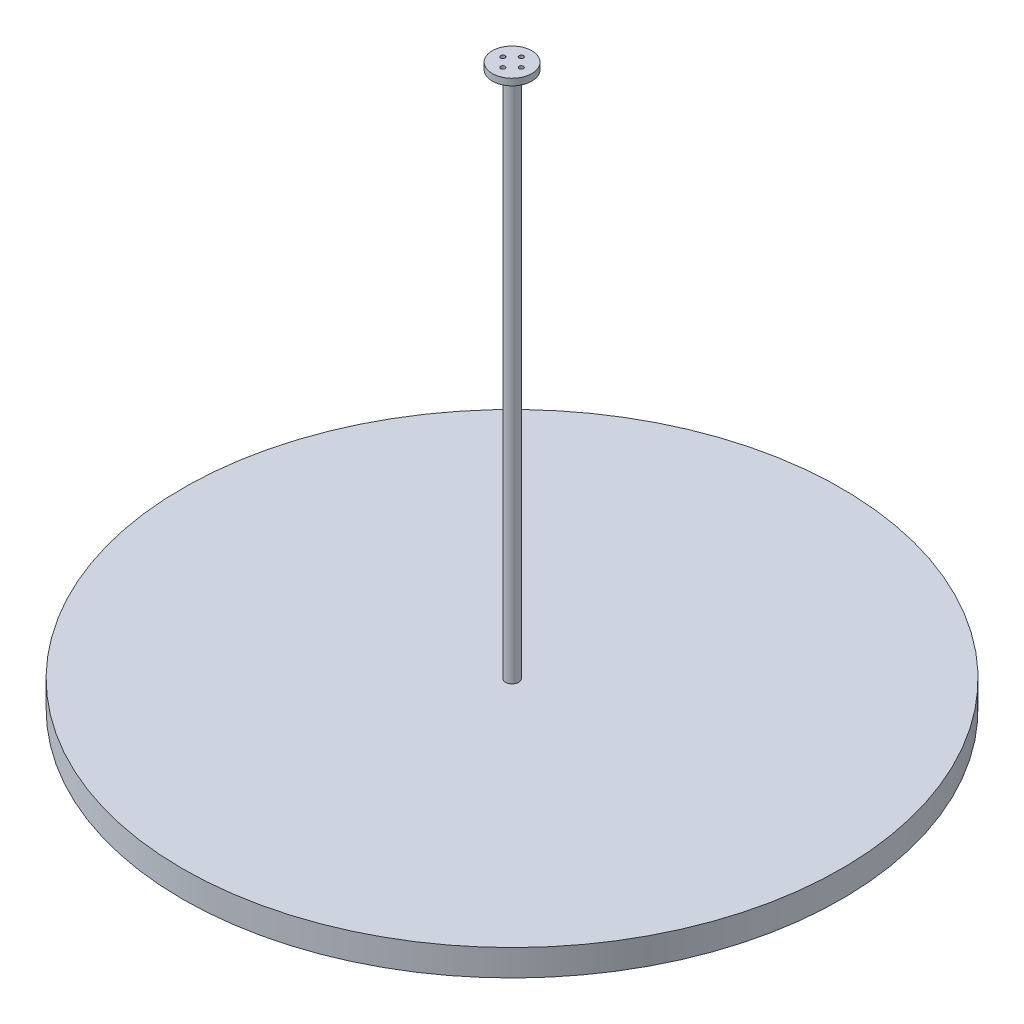
from build123d import *

# Parameters (mm, degrees)
SKETCH_1_R               = 250
EXTRUDE_1_DEPTH          = 20
SKETCH_2_R               = 5
EXTRUDE_2_DEPTH          = 400
SKETCH_3_R               = 15
EXTRUDE_3_DEPTH          = 5
SKETCH_4_R               = 1.65
CUT_EXTRUDE_1_DEPTH      = 5
PATTERN_CIRCULAR_1_COUNT = 4


with BuildPart() as part:
    # 草图1 → 凸台-拉伸1 (new body)
    with BuildSketch(Plane(origin=(0, 0, 0), x_dir=(1, 0, 0), z_dir=(0, 1, 0))):
        with Locations(Location((0, 0, 0), (0, 0, 270))):
            Circle(SKETCH_1_R)
    extrude(amount=EXTRUDE_1_DEPTH)

    # 草图2 → 凸台-拉伸2 (add)
    with BuildSketch(Plane(origin=(0, 20, 0), x_dir=(1, 0, 0), z_dir=(0, 1, 0))):
        with Locations(Location((0, 0, 0), (0, 0, 270))):
            Circle(SKETCH_2_R)
    extrude(amount=EXTRUDE_2_DEPTH)

    # 草图3 → 凸台-拉伸3 (add)
    with BuildSketch(Plane(origin=(0, 420, 0), x_dir=(1, 0, 0), z_dir=(0, 1, 0))):
        with Locations(Location((0, 0, 0), (0, 0, 270))):
            Circle(SKETCH_3_R)
    extrude(amount=EXTRUDE_3_DEPTH)

    # 草图4 → 切除-拉伸1 (cut)
    with BuildSketch(Plane(origin=(0, 425, 0), x_dir=(1, 0, 0), z_dir=(0, 1, 0))):
        with Locations(Location((-7, 0, 0), (0, 0, 270))):
            Circle(SKETCH_4_R)
    cut_extrude_1 = extrude(amount=-CUT_EXTRUDE_1_DEPTH, mode=Mode.SUBTRACT)

    # 阵列(圆周)1: 切除-拉伸1 ×4 about axis
    pattern_circular_1_axis = Axis((0, 0, 0), (0, 1, 0))
    for i in range(1, PATTERN_CIRCULAR_1_COUNT):
        add(cut_extrude_1.rotate(pattern_circular_1_axis, i * 360 / PATTERN_CIRCULAR_1_COUNT), mode=Mode.SUBTRACT)


solid = part.part
